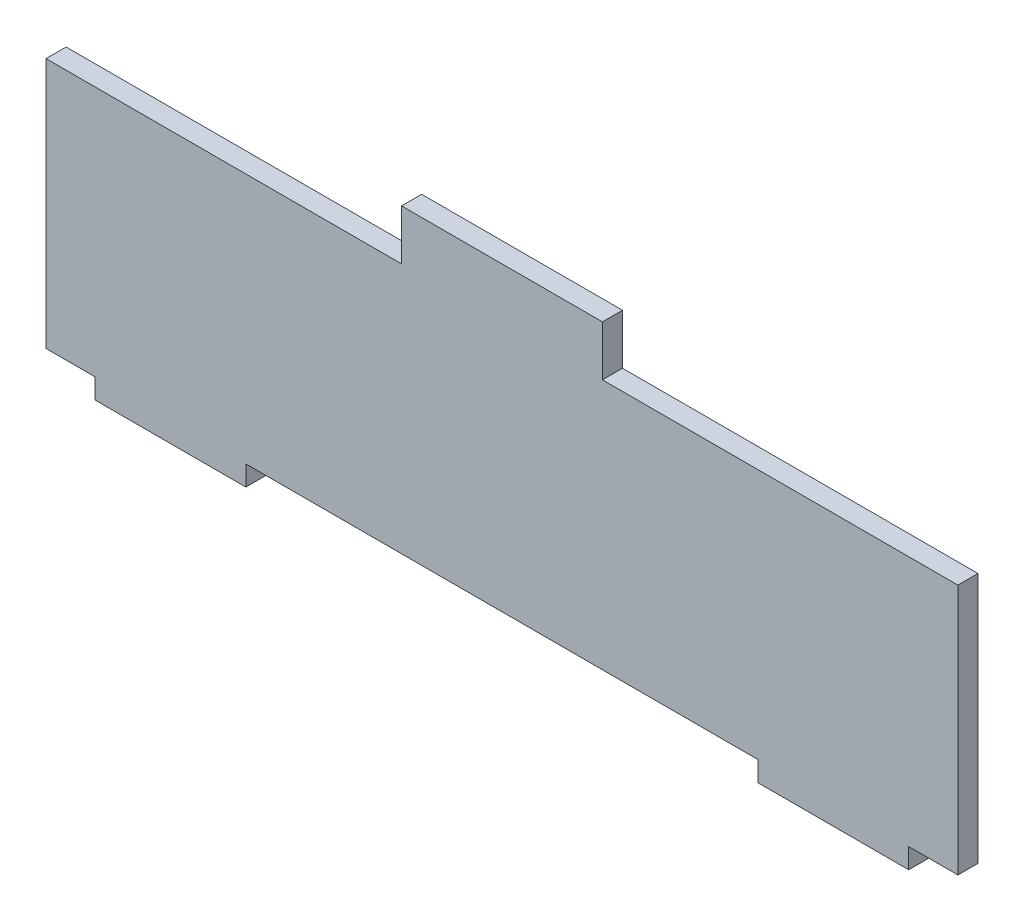
from build123d import *

# Parameters (mm, degrees)
SALIENTE_EXTRUIR1_DEPTH = 4


with BuildPart() as part:
    # Croquis1 → Saliente-Extruir1 (new body)
    with BuildSketch(Plane.XY):
        Polygon((-81, -25), (-81, -29), (-51, -29), (-51, -25), (51, -25), (51, -29), (81, -29), (81, -25), (90.8, -25), (90.8, 25), (20, 25), (20, 35), (-20, 35), (-20, 25), (-90.8, 25), (-90.8, -25), align=None)
    extrude(amount=SALIENTE_EXTRUIR1_DEPTH)


solid = part.part
